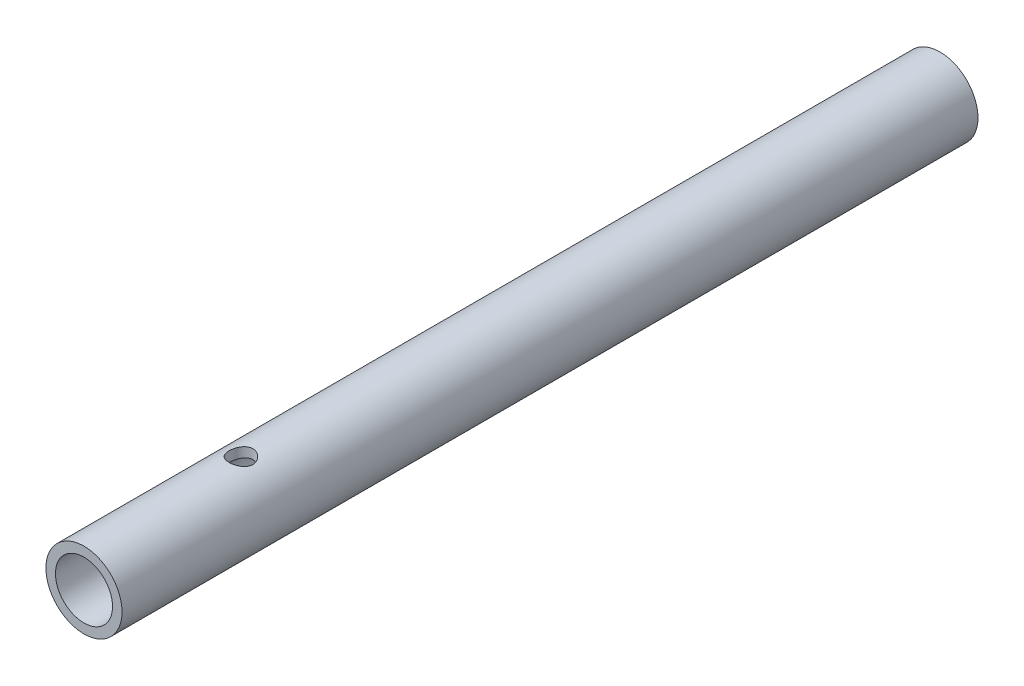
from build123d import *

# Parameters (mm, degrees)
ESQUISSE1_R               = 4
BOSS_EXTRU_1_DEPTH        = 90
ESQUISSE2_R               = 1.25
ENL_V_MAT_EXTRU_1_DEPTH   = 10
TROU_TARAUD_M3X0_51_D     = 2.5
TROU_TARAUD_M3X0_51_DEPTH = 12.5
TROU_TARAUD_M3X0_51_TIP   = 0.751075774
ESQUISSE6_R               = 3
ENL_V_MAT_EXTRU_2_DEPTH   = 91.177602649


with BuildPart() as part:
    # Esquisse1 → Boss.-Extru.1 (new body)
    with BuildSketch(Plane.XY):
        Circle(ESQUISSE1_R)
    extrude(amount=-BOSS_EXTRU_1_DEPTH)

    # Esquisse2 → Enlèv. mat.-Extru.1 (cut, symmetric)
    with BuildSketch(Plane(origin=(0, 0, 0), x_dir=(1, 0, 0), z_dir=(0, 1, 0))):
        with Locations(Location((0, 16.5, 0), (0, 0, 270))):
            Circle(ESQUISSE2_R)
    extrude(amount=ENL_V_MAT_EXTRU_1_DEPTH, both=True, mode=Mode.SUBTRACT)

    # Trou taraudé M3x0.51
    with Locations(Plane(origin=(0, 0, -90), x_dir=(-1, 0, 0), z_dir=(0, 0, -1))):
        with Locations((0, 0)):
            Hole(TROU_TARAUD_M3X0_51_D / 2, depth=TROU_TARAUD_M3X0_51_DEPTH)
            with Locations((0, 0, -(TROU_TARAUD_M3X0_51_DEPTH + TROU_TARAUD_M3X0_51_TIP / 2))):  # 118° drill point
                Cone(0, TROU_TARAUD_M3X0_51_D / 2, TROU_TARAUD_M3X0_51_TIP, mode=Mode.SUBTRACT)

    # Esquisse6 → Enlèv. mat.-Extru.2 (cut, through all)
    with BuildSketch(Plane.XY):
        Circle(ESQUISSE6_R)
    extrude(amount=-ENL_V_MAT_EXTRU_2_DEPTH, mode=Mode.SUBTRACT)


solid = part.part
